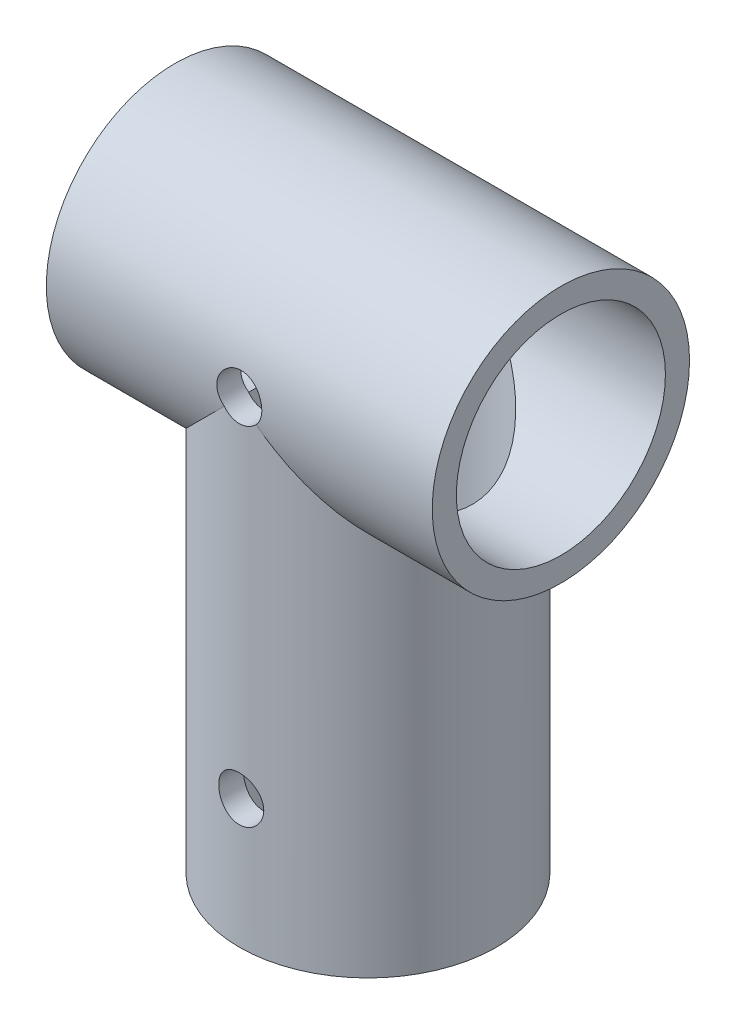
from build123d import *

# Parameters (mm, degrees)
SKETCH1_R                = 10
SKETCH1_R_2              = 8.125
BOSS_EXTRUDE1_DEPTH      = 25
SKETCH2_R                = 10
SKETCH2_R_2              = 8.125
BOSS_EXTRUDE2_DEPTH      = 15
BOSS_EXTRUDE4_REACH      = 32.822
BOSS_EXTRUDE4_END_RADIUS = 10
SKETCH4_R                = 10
CUT_EXTRUDE3_REACH       = 32.822
SKETCH7_R                = 8.125
CUT_EXTRUDE1_DEPTH       = 51.338851795
CUT_EXTRUDE1_DEPTH_BACK  = 51.338851795
SKETCH5_R                = 1.75
CUT_EXTRUDE2_DEPTH       = 51.338851814
CUT_EXTRUDE2_DEPTH_BACK  = 51.338851814
SKETCH6_R                = 1.75


with BuildPart() as part:
    # Sketch1 → Boss-Extrude1 (new body)
    with BuildSketch(Plane(origin=(0, 0, 0), x_dir=(1, 0, 0), z_dir=(0, 1, 0))):
        with Locations(Location((0, 0, 0), (0, 0, 270))):
            Circle(SKETCH1_R)
        with Locations(Location((0, 0, 0), (0, 0, 270))):
            Circle(SKETCH1_R_2, mode=Mode.SUBTRACT)
    extrude(amount=BOSS_EXTRUDE1_DEPTH)



with BuildPart() as body_2:
    # Sketch2 → Boss-Extrude2 (new, symmetric)
    with BuildSketch(Plane(origin=(0, 0, 0), x_dir=(0, 0, -1), z_dir=(1, 0, 0))):
        with Locations((0, 37)):
            Circle(SKETCH2_R)
        with Locations((0, 37)):
            Circle(SKETCH2_R_2, mode=Mode.SUBTRACT)
    extrude(amount=BOSS_EXTRUDE2_DEPTH, both=True)


with BuildPart() as part_1:
    add(part.part)

    add(body_2.part)  # Boss-Extrude4 merges body 2
    # Boss-Extrude4: up to this cylinder (the profile starts outside it)
    boss_extrude4_end = Plane(origin=(0, 37, 0), z_dir=(-1, 0, 0)) * Cylinder(BOSS_EXTRUDE4_END_RADIUS, 86.644, mode=Mode.PRIVATE)
    # Sketch4 → Boss-Extrude4 (add, up to the surface)
    with BuildSketch(Plane(origin=(0, 25, 0), x_dir=(1, 0, 0), z_dir=(0, 1, 0)), mode=Mode.PRIVATE) as boss_extrude4_sk1:
        with Locations(Location((0, 0, 0), (0, 0, 270))):
            Circle(SKETCH4_R)
    boss_extrude4_tool1 = extrude(boss_extrude4_sk1.sketch, amount=BOSS_EXTRUDE4_REACH, mode=Mode.PRIVATE) - boss_extrude4_end
    add(boss_extrude4_tool1.solids().sort_by_distance((0, 25, 0))[0])

    # Sketch7 → Cut-Extrude3 (cut, up to next)
    with BuildSketch(Plane.XZ.offset(-25), mode=Mode.PRIVATE) as cut_extrude3_sk1:
        with Locations(Location((0, 0, 0), (0, 0, 90))):
            Circle(SKETCH7_R)
    cut_extrude3_tool1 = extrude(cut_extrude3_sk1.sketch, amount=-CUT_EXTRUDE3_REACH, mode=Mode.PRIVATE) & part_1.part
    add(cut_extrude3_tool1.solids().sort_by_distance((0, 25, 0))[0], mode=Mode.SUBTRACT)

    # Sketch5 → Cut-Extrude1 (cut, two sides: drawn at the far end of the back side and taken through both)
    with BuildSketch(Plane.XY.offset(-CUT_EXTRUDE1_DEPTH_BACK)):
        with Locations((0, 10)):
            Circle(SKETCH5_R)
    extrude(amount=CUT_EXTRUDE1_DEPTH + CUT_EXTRUDE1_DEPTH_BACK, mode=Mode.SUBTRACT)

    # Sketch6 → Cut-Extrude2 (cut, two sides: drawn at the far end of the back side and taken through both)
    with BuildSketch(Plane.XY.offset(-CUT_EXTRUDE2_DEPTH_BACK)):
        with Locations(Location((0, 37, 0), (0, 0, 314.999999393))):
            Circle(SKETCH6_R)
    extrude(amount=CUT_EXTRUDE2_DEPTH + CUT_EXTRUDE2_DEPTH_BACK, mode=Mode.SUBTRACT)


solid = part_1.part
